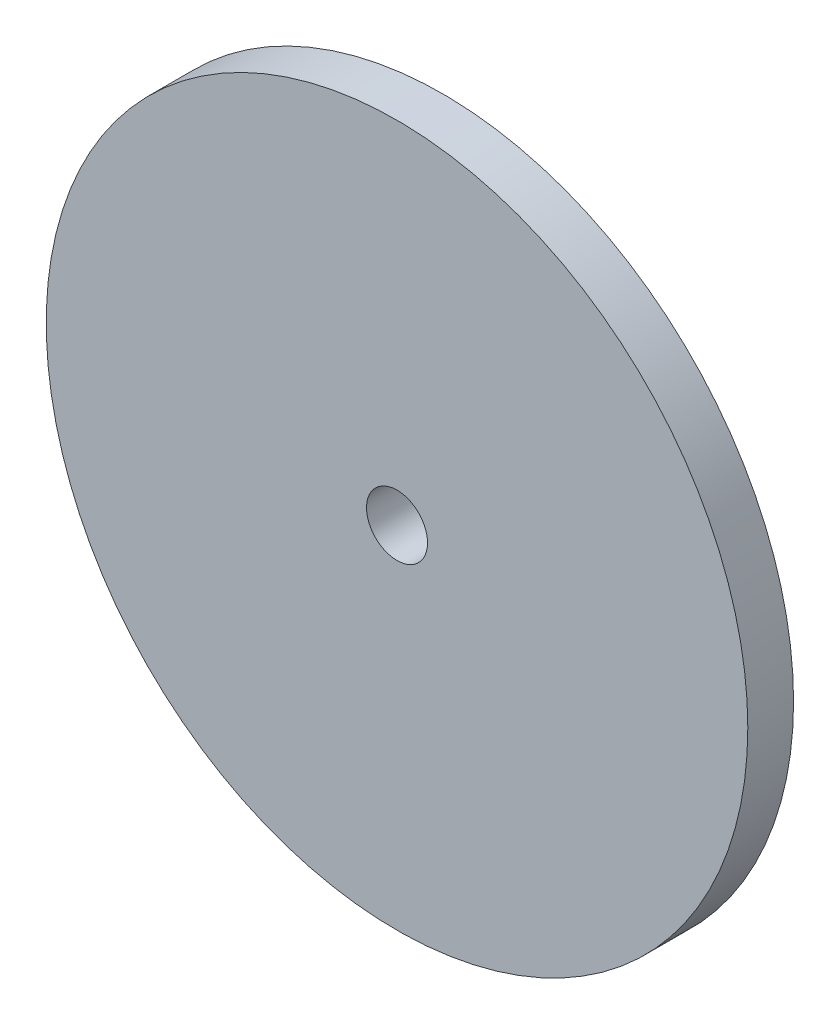
from build123d import *


with BuildPart() as part:
    # Sketch1 → Revolve1 (revolve)
    with BuildSketch(Plane(origin=(0, 0, 0), x_dir=(1, 0, 0), z_dir=(0, 1, 0))):
        Polygon((1, 0), (1, 6), (2.4, 6), (2.4, 1.5), (11.5, 1.5), (11.5, 0), align=None)
    revolve(axis=Axis((0, 0, 0), (0, 0, -1)))


solid = part.part
